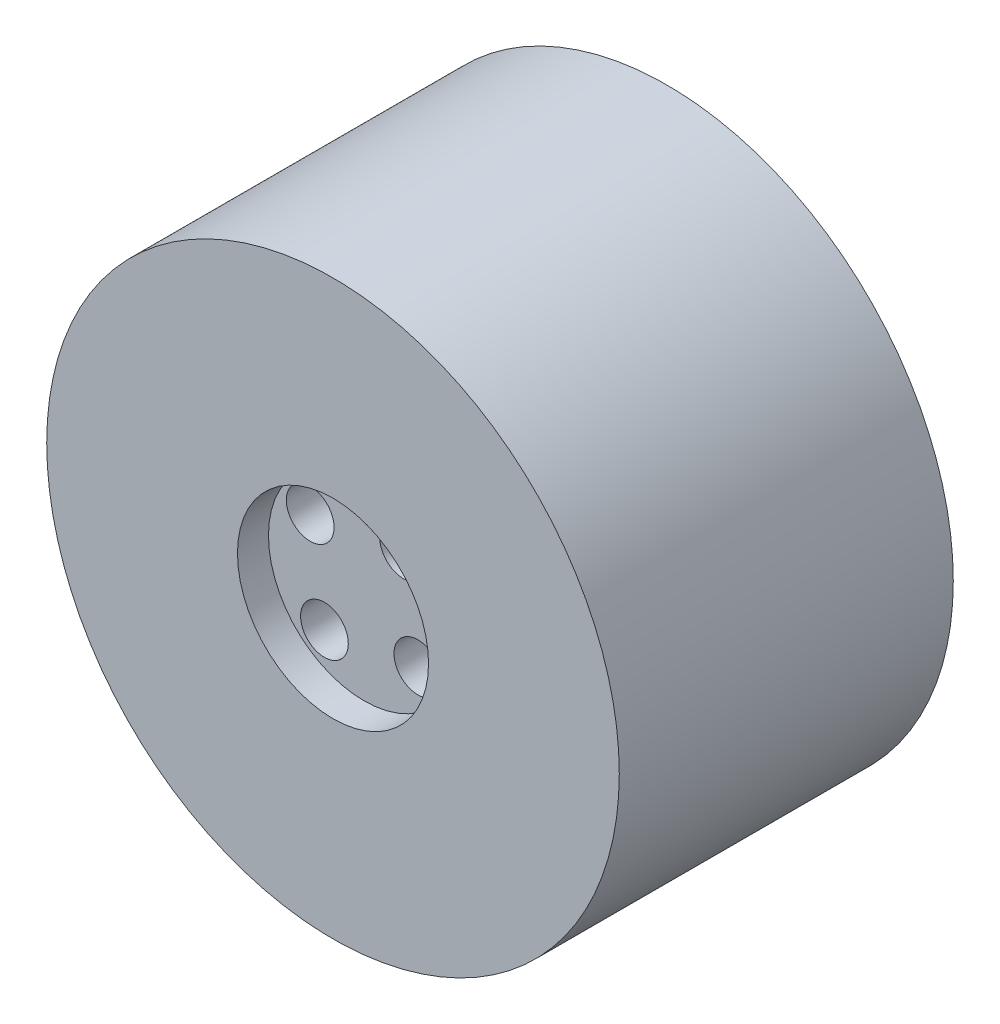
from build123d import *

# Parameters (mm, degrees)
SKETCH1_R           = 60
BOSS_EXTRUDE1_DEPTH = 70
SKETCH2_R           = 20.02
CUT_EXTRUDE1_DEPTH  = 6.5
SKETCH3_R           = 20
BOSS_EXTRUDE2_DEPTH = 6
SKETCH4_R           = 5
CUT_EXTRUDE2_DEPTH  = 114.912246927
CIRPATTERN1_COUNT   = 4


with BuildPart() as part:
    # Sketch1 → Boss-Extrude1 (new body)
    with BuildSketch(Plane.XY):
        Circle(SKETCH1_R)
    extrude(amount=BOSS_EXTRUDE1_DEPTH)

    # Sketch2 → Cut-Extrude1 (cut)
    with BuildSketch(Plane.XY.offset(70)):
        Circle(SKETCH2_R)
    extrude(amount=-CUT_EXTRUDE1_DEPTH, mode=Mode.SUBTRACT)

    # Sketch3 → Boss-Extrude2 (add)
    with BuildSketch(Plane(origin=(0, 0, 0), x_dir=(-1, 0, 0), z_dir=(0, 0, -1))):
        Circle(SKETCH3_R)
    extrude(amount=BOSS_EXTRUDE2_DEPTH)

    # Sketch4 → Cut-Extrude2 (cut, through all)
    with BuildSketch(Plane.XY.offset(70)):
        with Locations((-11.27834561, 8.294511456)):
            Circle(SKETCH4_R)
    cut_extrude2 = extrude(amount=-CUT_EXTRUDE2_DEPTH, mode=Mode.SUBTRACT)

    # CirPattern1: Cut-Extrude2 ×4 about axis
    cirpattern1_axis = Axis((0, 0, 0), (0, 0, 1))
    for i in range(1, CIRPATTERN1_COUNT):
        add(cut_extrude2.rotate(cirpattern1_axis, i * 360 / CIRPATTERN1_COUNT), mode=Mode.SUBTRACT)


solid = part.part
